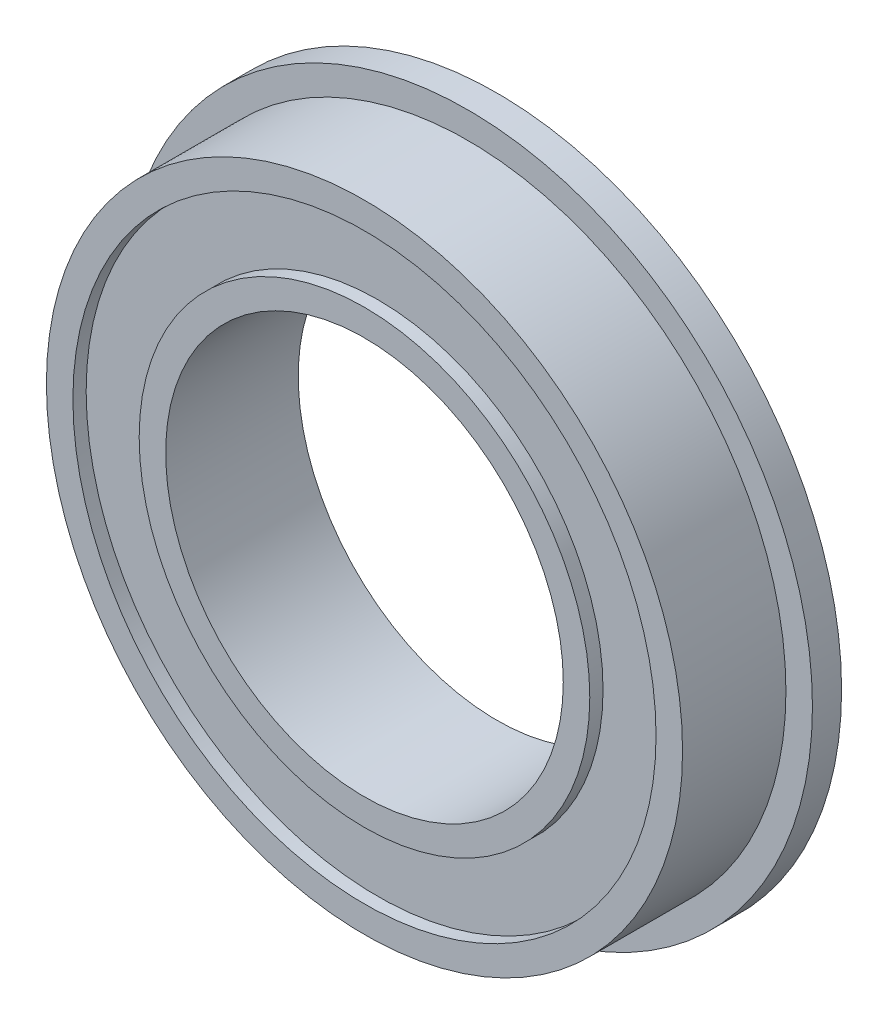
from build123d import *

# Parameters (mm, degrees)
SKETCH_2_W = 0.5
SKETCH_2_H = 2.5


with BuildPart() as part:
    # ｽｹｯﾁ1 → 回転1 (revolve)
    with BuildSketch(Plane(origin=(0, 0, 0), x_dir=(0, 0, -1), z_dir=(1, 0, 0)), mode=Mode.PRIVATE) as revolve_1_sk:
        Polygon((0, 7.5), (5, 7.5), (5, 13), (3.9, 13), (3.9, 12), (0, 12), align=None)
    revolve(revolve_1_sk.sketch.rotate(Axis((0, 0, 0), (0, 0, -1)), 90), axis=Axis((0, 0, 0), (0, 0, -1)))

    # ｽｹｯﾁ2 → ｶｯﾄ - 回転1 (revolve, cut)
    with BuildSketch(Plane(origin=(0, 0, 0), x_dir=(0, 0, -1), z_dir=(1, 0, 0)), mode=Mode.PRIVATE) as cut_revolve_1_sk:
        with Locations((0.25, 9.75)):
            Rectangle(SKETCH_2_W, SKETCH_2_H)
        with Locations((4.75, 9.75)):
            Rectangle(SKETCH_2_W, SKETCH_2_H)
    revolve(cut_revolve_1_sk.sketch.rotate(Axis((0, 0, 0), (0, 0, -1)), 90), axis=Axis((0, 0, 0), (0, 0, -1)), mode=Mode.SUBTRACT)


solid = part.part
